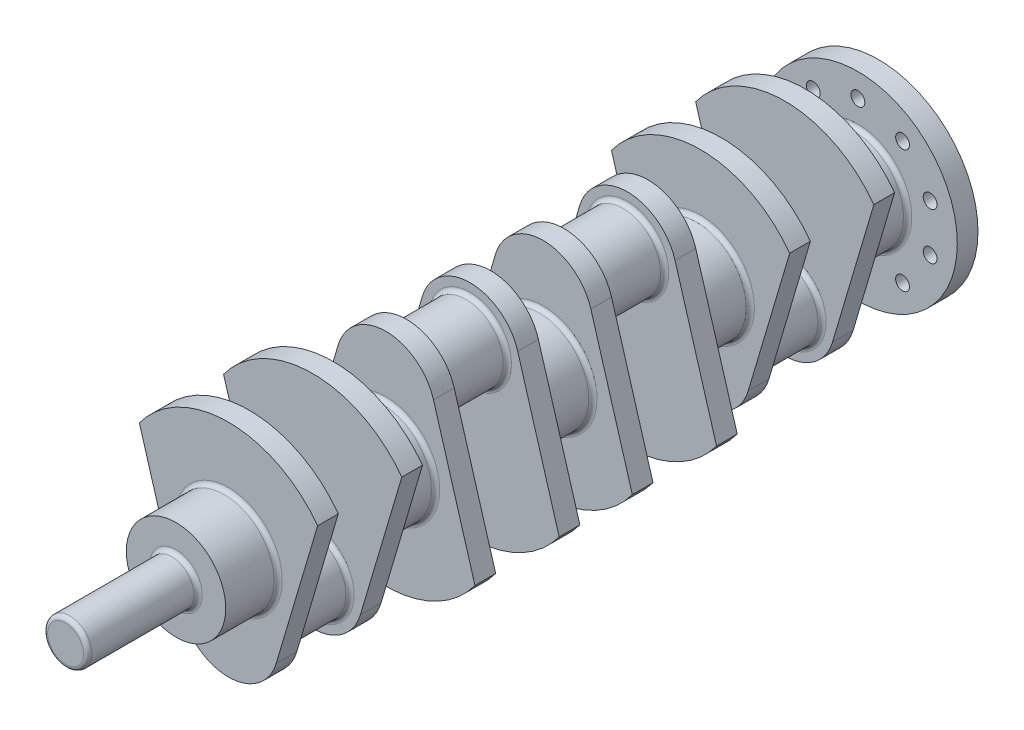
from build123d import *

# Parameters (mm, degrees)
SKETCH1_R             = 36
BOSS_EXTRUDE1_DEPTH   = 15
SKETCH2_R             = 27
BOSS_EXTRUDE2_DEPTH   = 46
SKETCH3_R             = 36
BOSS_EXTRUDE3_DEPTH   = 38
BODY_MOVE_COPY1_ANGLE = 180
SKETCH5_R             = 16
BOSS_EXTRUDE4_DEPTH   = 80
SKETCH6_R             = 72
BOSS_EXTRUDE5_DEPTH   = 15
SKETCH7_R             = 5
CUT_EXTRUDE1_DEPTH    = 15
FILLET1_R             = 3


with BuildPart() as part:
    # Sketch1 → Boss-Extrude1 (new body)
    with BuildSketch(Plane.XY):
        with BuildLine():
            ThreePointArc((64.569893475, 47.23059238), (0, 80), (-64.569893475, 47.23059238))
            Line((-64.569893475, 47.23059238), (-34.517510455, -54.224552409))
            ThreePointArc((-34.517510455, -54.224552409), (-5.165734392, -8.372550074), (36, -44))
            ThreePointArc((36, -44), (35.627449926, -49.165734392), (34.517510455, -54.224552409))
            Line((34.517510455, -54.224552409), (64.569893475, 47.23059238))
        make_face()
        with Locations((0, -44)):
            Circle(SKETCH1_R)
    boss_extrude1 = extrude(amount=BOSS_EXTRUDE1_DEPTH)

    # Sketch2 → Boss-Extrude2 (add)
    with BuildSketch(Plane.XY.offset(15)):
        with Locations((0, -44)):
            Circle(SKETCH2_R)
    extrude(amount=BOSS_EXTRUDE2_DEPTH)

    # Sketch3 → Boss-Extrude3 (add)
    with BuildSketch(Plane(origin=(0, 0, 0), x_dir=(-1, 0, 0), z_dir=(0, 0, -1))):
        Circle(SKETCH3_R)
    boss_extrude3 = extrude(amount=BOSS_EXTRUDE3_DEPTH)

    # Mirror1: Boss-Extrude1, Boss-Extrude3 across plane
    add(boss_extrude1.mirror(Plane.XY.offset(38)))
    add(boss_extrude3.mirror(Plane.XY.offset(38)))


with BuildPart() as body_2:
    # Mirror2: mirrored copy
    add(part.part.mirror(Plane.XY.offset(95)))


with BuildPart() as body_2_1:
    # Body-Move/Copy1: moved
    add(body_2.part.rotate(Axis((0, 0, 152), (1, 0, 0)), BODY_MOVE_COPY1_ANGLE))


with BuildPart() as body_3:
    # Mirror3: mirrored copy
    add(body_2_1.part.mirror(Plane.XY.offset(209)))


with BuildPart() as body_4:
    # Mirror3 2: mirrored copy
    add(part.part.mirror(Plane.XY.offset(209)))

    # Sketch5 → Boss-Extrude4 (add)
    with BuildSketch(Plane.XY.offset(456)):
        Circle(SKETCH5_R)
    extrude(amount=BOSS_EXTRUDE4_DEPTH)


with BuildPart() as part_1:
    add(part.part)

    # Sketch6 → Boss-Extrude5 (add)
    with BuildSketch(Plane(origin=(0, 0, -38), x_dir=(-1, 0, 0), z_dir=(0, 0, -1))):
        Circle(SKETCH6_R)
    extrude(amount=BOSS_EXTRUDE5_DEPTH)

    # Sketch7 → Cut-Extrude1 (cut)
    with BuildSketch(Plane(origin=(0, 0, -53), x_dir=(-1, 0, 0), z_dir=(0, 0, -1))):
        with Locations((0, 55)):
            Circle(SKETCH7_R)
        with Locations((32.328188876, 44.495934691)):
            Circle(SKETCH7_R)
        with Locations((52.308108396, 16.995934691)):
            Circle(SKETCH7_R)
        with Locations((52.308108396, -16.995934691)):
            Circle(SKETCH7_R)
        with Locations((32.328188876, -44.495934691)):
            Circle(SKETCH7_R)
        with Locations((0, -55)):
            Circle(SKETCH7_R)
        with Locations((-32.328188876, -44.495934691)):
            Circle(SKETCH7_R)
        with Locations((-52.308108396, -16.995934691)):
            Circle(SKETCH7_R)
        with Locations((-52.308108396, 16.995934691)):
            Circle(SKETCH7_R)
        with Locations((-32.328188876, 44.495934691)):
            Circle(SKETCH7_R)
    extrude(amount=-CUT_EXTRUDE1_DEPTH, mode=Mode.SUBTRACT)


with BuildPart() as body_4_1:
    add(body_4.part)

    # Combine1: union body 3, body 2, part
    add(body_3.part)
    add(body_2_1.part)
    add(part_1.part)

    # Fillet1
    fillet1_edges = [body_4_1.edges().sort_by_distance(p)[0] for p in [
        (-27, -44, 403),
        (-27, -44, 357),
        (36, 0, 418),
        (36, 0, 304),
        (36, 0, 342),
        (-16, 0, 456),
        (-16, 0, 536),
        (-27, 44, 289),
        (-27, 44, 243),
        (36, 0, 228),
        (36, 0, 190),
        (-27, 44, 129),
        (36, 0, 114),
        (-27, 44, 175),
        (-27, -44, 15),
        (36, 0, 0),
        (-27, -44, 61),
        (36, 0, 76),
        (36, 0, -38),
    ]]
    fillet(fillet1_edges, radius=FILLET1_R)


solid = body_4_1.part
